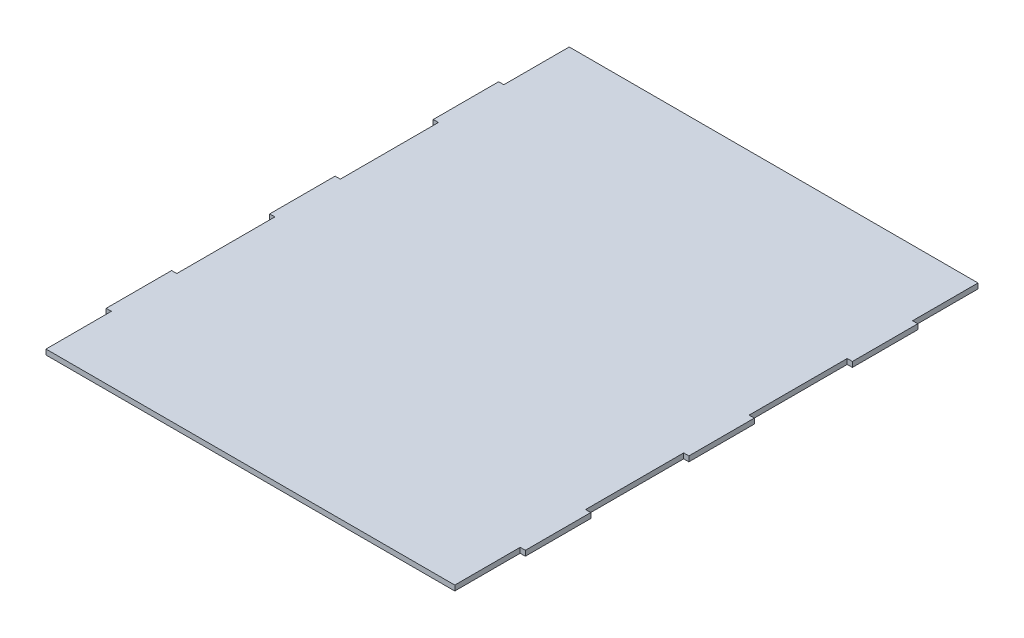
from build123d import *

# Parameters (mm, degrees)
SKETCH1_W           = 250
SKETCH1_H           = 320
BOSS_EXTRUDE1_DEPTH = 3.175
SKETCH2_W           = 3.175
SKETCH2_H           = 40
BOSS_EXTRUDE2_DEPTH = 3.175


with BuildPart() as part:
    # Sketch1 → Boss-Extrude1 (new body)
    with BuildSketch(Plane(origin=(0, 0, 0), x_dir=(1, 0, 0), z_dir=(0, 1, 0))):
        with Locations((125, -160)):
            Rectangle(SKETCH1_W, SKETCH1_H)
    extrude(amount=BOSS_EXTRUDE1_DEPTH)

    # Sketch2 → Boss-Extrude2 (add)
    with BuildSketch(Plane(origin=(0, 3.175, 0), x_dir=(1, 0, 0), z_dir=(0, 1, 0))):
        with Locations((-1.5875, -60)):
            Rectangle(SKETCH2_W, SKETCH2_H)
        with Locations((251.5875, -60)):
            Rectangle(SKETCH2_W, SKETCH2_H)
        with Locations((251.5875, -160)):
            Rectangle(SKETCH2_W, SKETCH2_H)
        with Locations((-1.5875, -160)):
            Rectangle(SKETCH2_W, SKETCH2_H)
        with Locations((251.5875, -260)):
            Rectangle(SKETCH2_W, SKETCH2_H)
        with Locations((-1.5875, -260)):
            Rectangle(SKETCH2_W, SKETCH2_H)
    extrude(amount=-BOSS_EXTRUDE2_DEPTH)


solid = part.part
